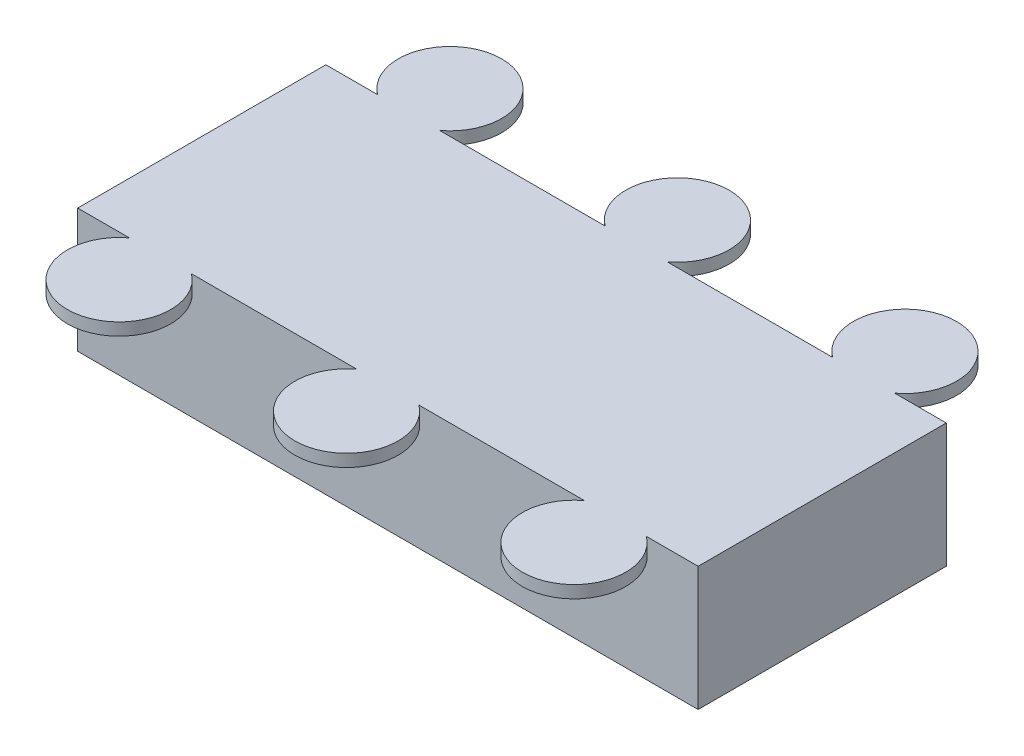
from build123d import *

# Parameters (mm, degrees)
SKETCH1_W           = 1500
SKETCH1_H           = 600
BOSS_EXTRUDE1_DEPTH = 300
BOSS_EXTRUDE2_DEPTH = 30


with BuildPart() as part:
    # Sketch1 → Boss-Extrude1 (new body)
    with BuildSketch(Plane(origin=(0, 0, 0), x_dir=(1, 0, 0), z_dir=(0, 1, 0))):
        Rectangle(SKETCH1_W, SKETCH1_H)
    extrude(amount=BOSS_EXTRUDE1_DEPTH)

    # Sketch2 → Boss-Extrude2 (add)
    with BuildSketch(Plane(origin=(0, 300, 0), x_dir=(1, 0, 0), z_dir=(0, 1, 0))):
        with BuildLine():
            Line((-75, -300), (75, -300))
            ThreePointArc((75, -300), (0, -525), (-75, -300))
        make_face()
        with BuildLine():
            Line((-75, 300), (75, 300))
            ThreePointArc((75, 300), (0, 525), (-75, 300))
        make_face()
        with BuildLine():
            Line((625, -300), (475, -300))
            ThreePointArc((475, -300), (550, -525), (625, -300))
        make_face()
        with BuildLine():
            Line((625, 300), (475, 300))
            ThreePointArc((475, 300), (550, 525), (625, 300))
        make_face()
        with BuildLine():
            Line((-475, -300), (-625, -300))
            ThreePointArc((-625, -300), (-550, -525), (-475, -300))
        make_face()
        with BuildLine():
            Line((-475, 300), (-625, 300))
            ThreePointArc((-625, 300), (-550, 525), (-475, 300))
        make_face()
    extrude(amount=-BOSS_EXTRUDE2_DEPTH)


solid = part.part
